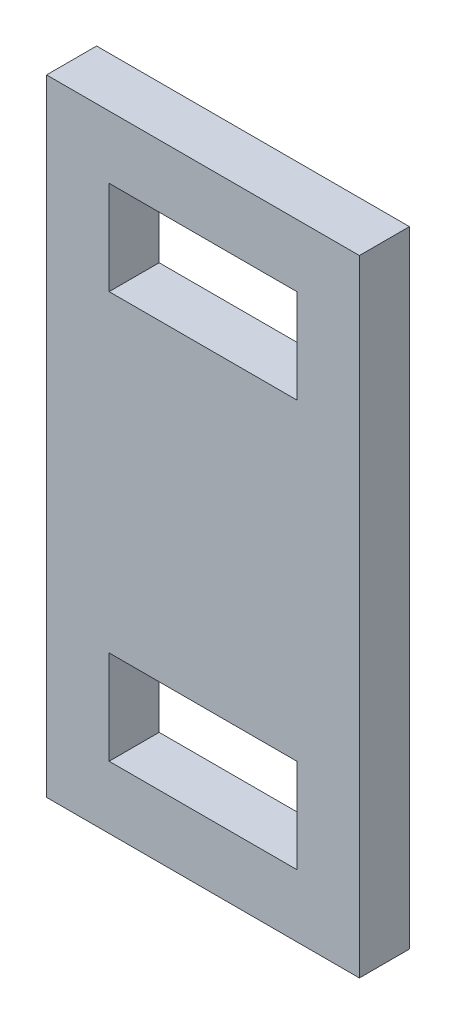
from build123d import *

# Parameters (mm, degrees)
ESQUISSE1_W        = 5
ESQUISSE1_H        = 10
ESQUISSE1_W_2      = 3
ESQUISSE1_H_2      = 1.5
BOSS_EXTRU_1_DEPTH = 0.8


with BuildPart() as part:
    # Esquisse1 → Boss.-Extru.1 (new body)
    with BuildSketch(Plane.XY):
        Rectangle(ESQUISSE1_W, ESQUISSE1_H)
        with Locations((0, -3.25)):
            Rectangle(ESQUISSE1_W_2, ESQUISSE1_H_2, mode=Mode.SUBTRACT)
        with Locations((0, 3.25)):
            Rectangle(ESQUISSE1_W_2, ESQUISSE1_H_2, mode=Mode.SUBTRACT)
    extrude(amount=BOSS_EXTRU_1_DEPTH)


solid = part.part
